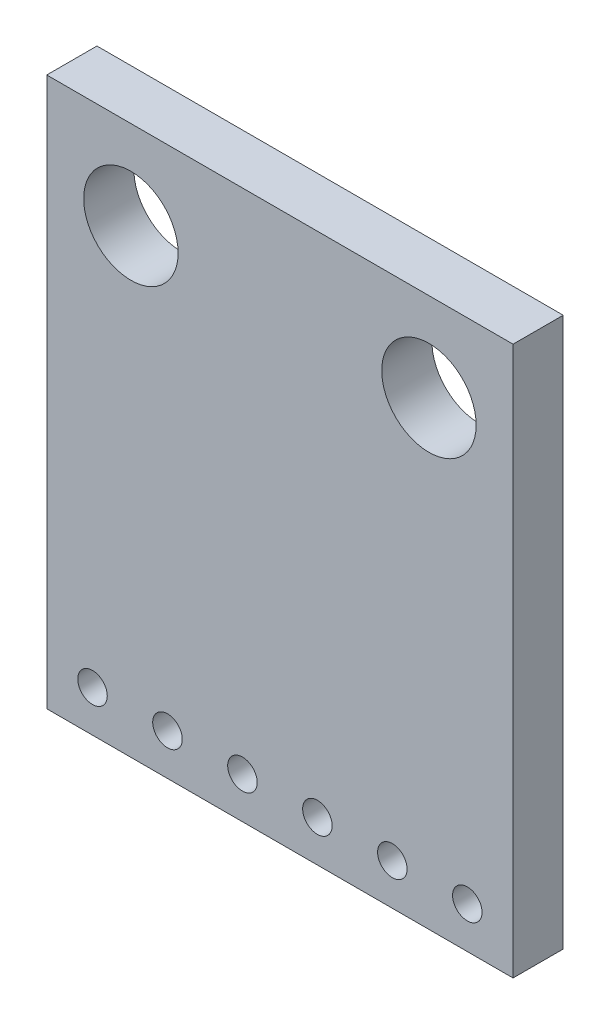
from build123d import *

# Parameters (mm, degrees)
SKETCH1_W           = 15.8
SKETCH1_H           = 18.6
SKETCH1_R           = 1.6
SKETCH1_R_2         = 0.5
BOSS_EXTRUDE1_DEPTH = 1.7


with BuildPart() as part:
    # Sketch1 → Boss-Extrude1 (new body)
    with BuildSketch(Plane.XY):
        Rectangle(SKETCH1_W, SKETCH1_H)
        with Locations((-5.05, 6.3)):
            Circle(SKETCH1_R, mode=Mode.SUBTRACT)
        with Locations((5.05, 6.3)):
            Circle(SKETCH1_R, mode=Mode.SUBTRACT)
        with Locations((-6.35, -7.9)):
            Circle(SKETCH1_R_2, mode=Mode.SUBTRACT)
        with Locations((-3.81, -7.9)):
            Circle(SKETCH1_R_2, mode=Mode.SUBTRACT)
        with Locations((-1.27, -7.9)):
            Circle(SKETCH1_R_2, mode=Mode.SUBTRACT)
        with Locations((1.27, -7.9)):
            Circle(SKETCH1_R_2, mode=Mode.SUBTRACT)
        with Locations((3.81, -7.9)):
            Circle(SKETCH1_R_2, mode=Mode.SUBTRACT)
        with Locations((6.35, -7.9)):
            Circle(SKETCH1_R_2, mode=Mode.SUBTRACT)
    extrude(amount=BOSS_EXTRUDE1_DEPTH)


solid = part.part
